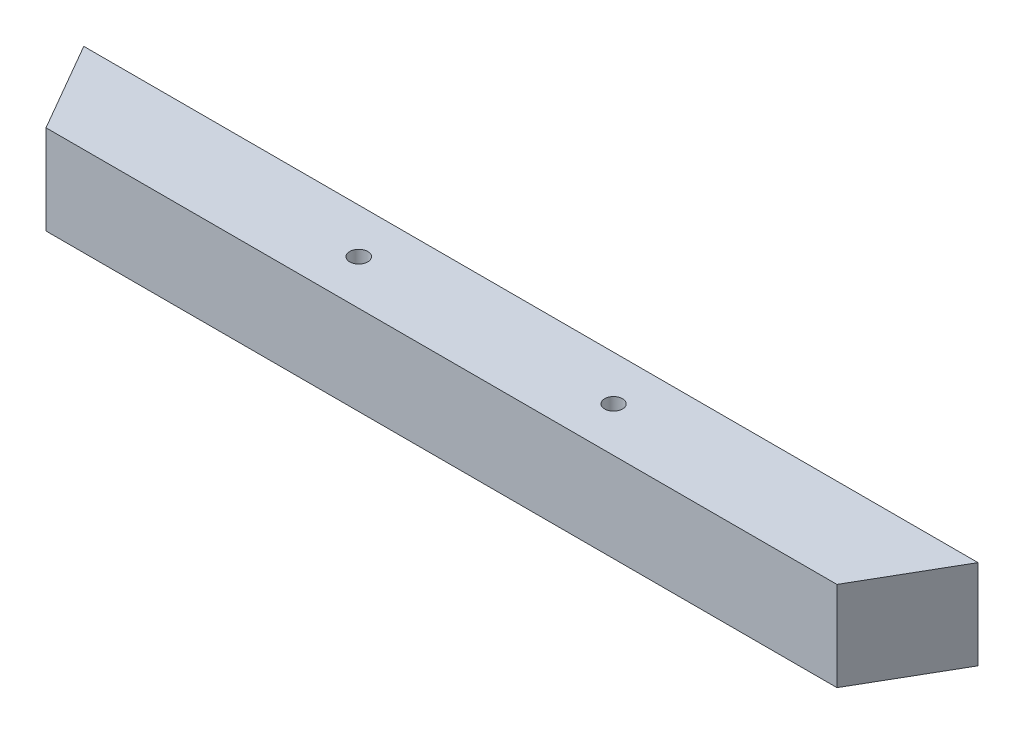
from build123d import *

# Parameters (mm, degrees)
SKETCH1_R           = 2.019595556
SKETCH1_R_2         = 2
BOSS_EXTRUDE1_DEPTH = 20


with BuildPart() as part:
    # Sketch1 → Boss-Extrude1 (new body)
    with BuildSketch(Plane(origin=(0, 0, 0), x_dir=(1, 0, 0), z_dir=(0, 1, 0))):
        Polygon((-100, 0), (100, 0), (88.452994616, -20), (-88.452994616, -20), align=None)
        with Locations(Location((-28.5, -10, 0), (0, 0, 270))):
            Circle(SKETCH1_R, mode=Mode.SUBTRACT)
        with Locations(Location((28.5, -10, 0), (0, 0, 270))):
            Circle(SKETCH1_R_2, mode=Mode.SUBTRACT)
    extrude(amount=BOSS_EXTRUDE1_DEPTH)


solid = part.part
